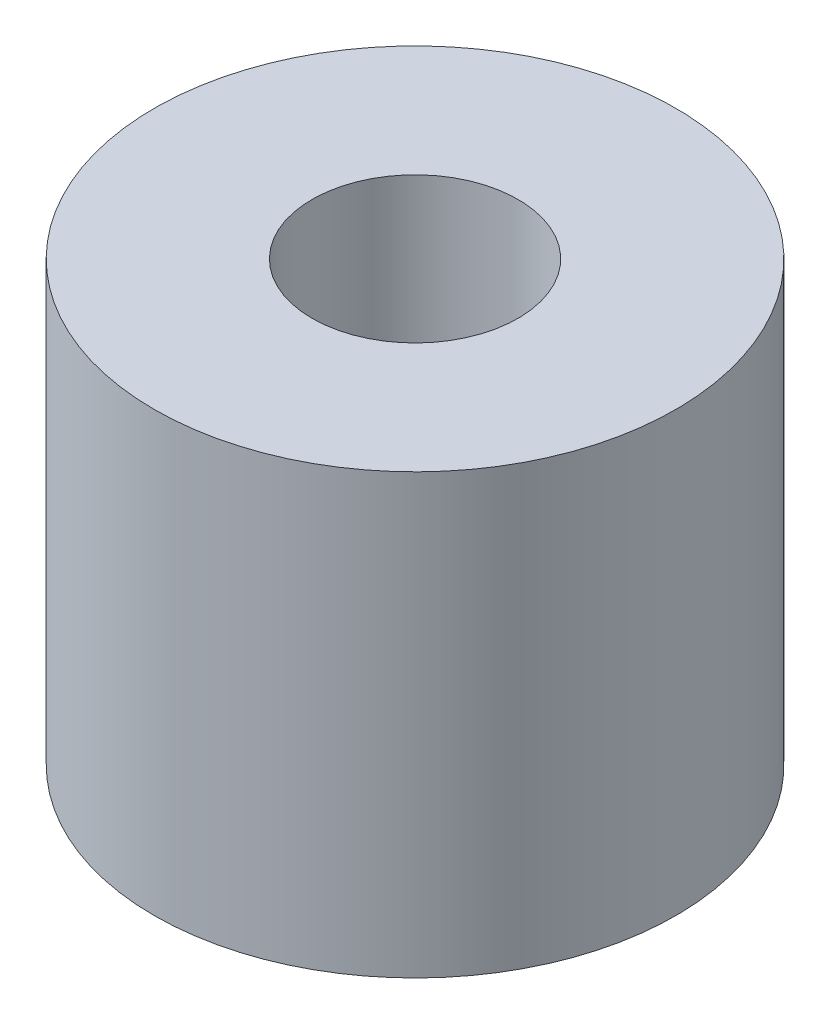
from build123d import *

# Parameters (mm, degrees)
SKETCH1_R           = 2.975
SKETCH1_R_2         = 1.175
BOSS_EXTRUDE1_DEPTH = 5


with BuildPart() as part:
    # Sketch1 → Boss-Extrude1 (new body)
    with BuildSketch(Plane(origin=(0, 0, 0), x_dir=(1, 0, 0), z_dir=(0, 1, 0))):
        with Locations(Location((0, 0, 0), (0, 0, 270))):
            Circle(SKETCH1_R)
        with Locations(Location((0, 0, 0), (0, 0, 270))):
            Circle(SKETCH1_R_2, mode=Mode.SUBTRACT)
    extrude(amount=BOSS_EXTRUDE1_DEPTH)


solid = part.part
